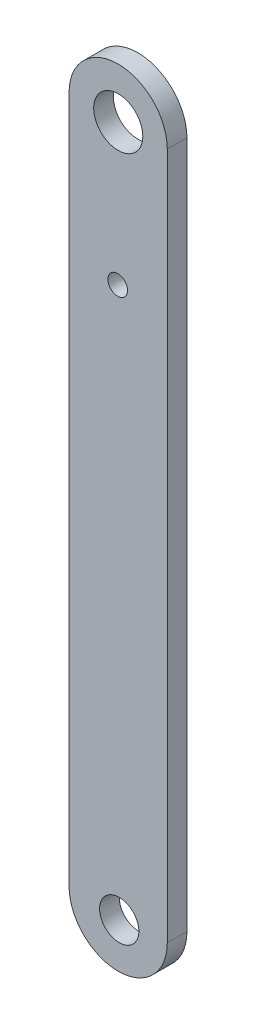
from build123d import *

# Parameters (mm, degrees)
BOSS_EXTRUDE1_DEPTH = 2
SKETCH2_R           = 2.5
SKETCH2_R_2         = 1
SKETCH2_R_3         = 2
CUT_EXTRUDE1_DEPTH  = 2


with BuildPart() as part:
    # Sketch1 → Boss-Extrude1 (new body)
    with BuildSketch(Plane.XY):
        with BuildLine():
            Line((-23.340741152, 36.829268293), (-23.340741152, -33.170731707))
            ThreePointArc((-23.340741152, -33.170731707), (-18.340741152, -38.170731707), (-13.340741152, -33.170731707))
            Line((-13.340741152, -33.170731707), (-13.340741152, 36.829268293))
            ThreePointArc((-13.340741152, 36.829268293), (-18.340741152, 41.829268293), (-23.340741152, 36.829268293))
        make_face()
    extrude(amount=BOSS_EXTRUDE1_DEPTH)

    # Sketch2 → Cut-Extrude1 (cut)
    with BuildSketch(Plane.XY.offset(2)):
        with Locations((-18.335951237, 36.709742662)):
            Circle(SKETCH2_R)
        with Locations((-18.387056332, 22.33048964)):
            Circle(SKETCH2_R_2)
        with Locations((-18.233156774, -33.591456918)):
            Circle(SKETCH2_R_3)
    extrude(amount=-CUT_EXTRUDE1_DEPTH, mode=Mode.SUBTRACT)


solid = part.part
